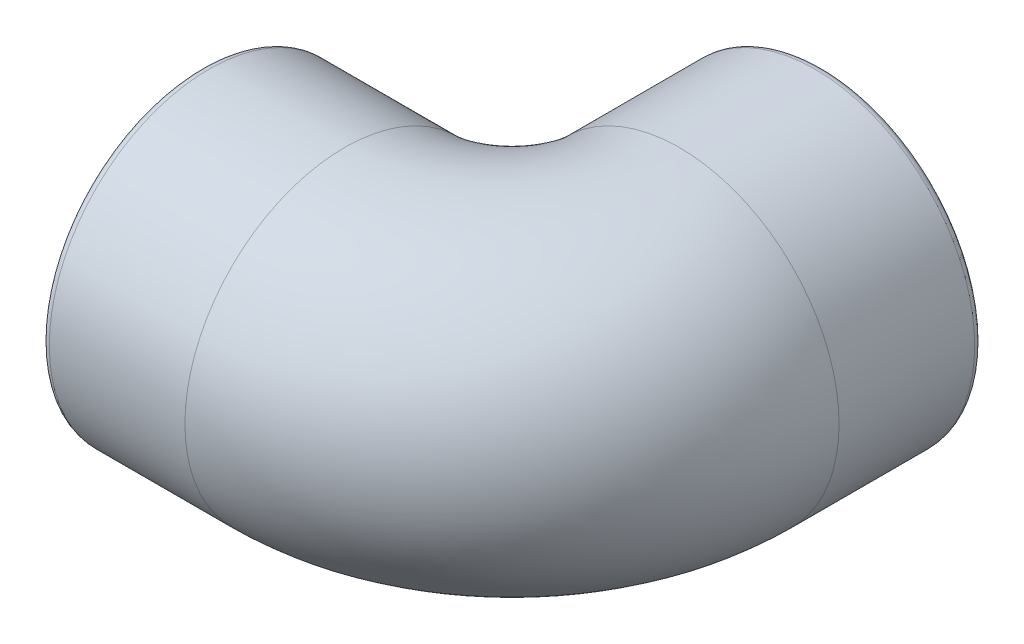
from build123d import *

# Parameters (mm, degrees)
CROQUIS1_R               = 20
CROQUIS1_R_2             = 17
REVOLUCI_N_L_MINA1_ANGLE = 90
CROQUIS3_R               = 20
CROQUIS3_R_2             = 17
EXTRUIR1_DEPTH           = 18
CROQUIS4_R               = 20
CROQUIS4_R_2             = 17
EXTRUIR2_DEPTH           = 18
REDONDEO1_R              = 1


with BuildPart() as part:
    # Croquis1 → Revolución-Lámina1 (revolve)
    with BuildSketch(Plane(origin=(0, 0, 0), x_dir=(0, 0, -1), z_dir=(1, 0, 0))):
        with Locations((-21, 0)):
            Circle(CROQUIS1_R)
        with Locations((-21, 0)):
            Circle(CROQUIS1_R_2, mode=Mode.SUBTRACT)
    revolve(axis=Axis((0, 0, 0), (0, 1, 0)), revolution_arc=REVOLUCI_N_L_MINA1_ANGLE)

    # Croquis3 → Extruir1 (add)
    with BuildSketch(Plane.ZY):
        with Locations((21, 0)):
            Circle(CROQUIS3_R)
        with Locations((21, 0)):
            Circle(CROQUIS3_R_2, mode=Mode.SUBTRACT)
    extrude(amount=EXTRUIR1_DEPTH)

    # Croquis4 → Extruir2 (add)
    with BuildSketch(Plane(origin=(0, 0, 0), x_dir=(-1, 0, 0), z_dir=(0, 0, -1))):
        with Locations(Location((-21, 0, 0), (0, 0, 180))):
            Circle(CROQUIS4_R)
        with Locations(Location((-21, 0, 0), (0, 0, 180))):
            Circle(CROQUIS4_R_2, mode=Mode.SUBTRACT)
    extrude(amount=EXTRUIR2_DEPTH)

    # Redondeo1
    redondeo1_edges = [part.edges().sort_by_distance(p)[0] for p in [
        (1, 0, -18),
        (-18, 0, 1),
    ]]
    fillet(redondeo1_edges, radius=REDONDEO1_R)


solid = part.part
